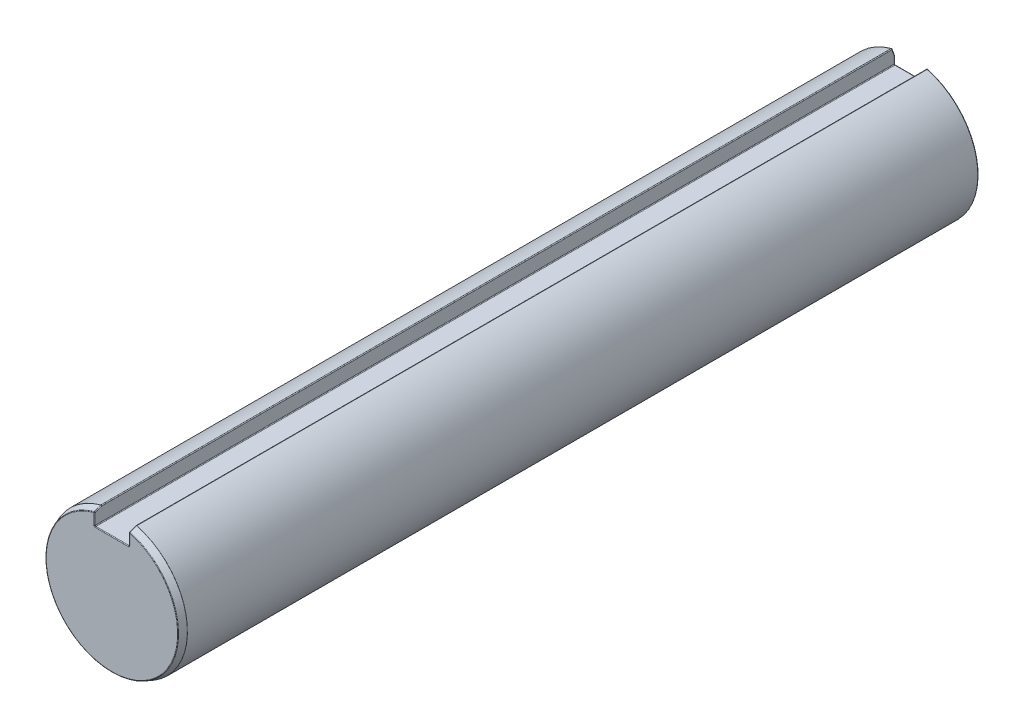
from build123d import *
from OCP.BRepFilletAPI import BRepFilletAPI_MakeChamfer

# Parameters (mm, degrees)
BOSS_EXTRUDE1_DEPTH      = 27.75
BOSS_EXTRUDE1_DEPTH_BACK = 27.75
CHAMFER1_SIZE            = 0.47625
CHAMFER1_SIZE2           = 0.173340824
FILLET1_R                = 0.047625


with BuildPart() as part:
    # Sketch3 → Boss-Extrude1 (new, two sides: drawn at the far end of the back side and taken through both)
    with BuildSketch(Plane.XY.offset(-BOSS_EXTRUDE1_DEPTH_BACK)):
        with BuildLine():
            Line((-1.1938, 3.571875), (-1.1938, 4.610449849))
            ThreePointArc((-1.1938, 4.610449849), (-2.915127249, -3.766090728), (4.7625, 0))
            ThreePointArc((4.7625, 0), (3.766090728, 2.915127249), (1.1938, 4.610449849))
            Line((1.1938, 4.610449849), (1.1938, 3.571875))
            Line((1.1938, 3.571875), (-1.1938, 3.571875))
        make_face()
    extrude(amount=BOSS_EXTRUDE1_DEPTH + BOSS_EXTRUDE1_DEPTH_BACK)

    # Chamfer1: one chamfer whose edges measure the first distance from different faces: ONE call of the kernel's chamfer builder (chamfer() names one face for all edges)
    chamfer1_edges_1 = [part.edges().sort_by_distance(p)[0] for p in [
        (-2.915127249, -3.766090728, -27.75),
    ]]
    chamfer1_side_1 = [part.faces().sort_by_distance(p)[0] for p in [
        (0, -0.164578508, -27.75),
    ]]
    chamfer1_edges_2 = [part.edges().sort_by_distance(p)[0] for p in [
        (-2.915127249, -3.766090728, 27.75),
    ]]
    chamfer1_side_2 = [part.faces().sort_by_distance(p)[0] for p in [
        (-2.915127249, -3.766090728, 13.875),
    ]]
    chamfer1 = BRepFilletAPI_MakeChamfer(part.part.solid().wrapped)
    for e in chamfer1_edges_1:
        chamfer1.Add(CHAMFER1_SIZE, CHAMFER1_SIZE2, e.wrapped, chamfer1_side_1[0].wrapped)  # the first distance lies on this face
    for e in chamfer1_edges_2:
        chamfer1.Add(CHAMFER1_SIZE, CHAMFER1_SIZE2, e.wrapped, chamfer1_side_2[0].wrapped)  # the first distance lies on this face
    add(Compound.cast(chamfer1.Shape()), mode=Mode.REPLACE)

    # Fillet1
    fillet1_edges = [part.edges().sort_by_distance(p)[0] for p in [
        (-2.791222288, -3.642727012, 27.75),
        (-1.1938, 4.36360182, -27.663482035),
        (-1.1938, 4.520858199, 27.511894109),
        (-2.574394474, -3.42701505, -27.75),
        (1.1938, 4.36360182, -27.663482035),
        (1.1938, 4.520858199, 27.511894109),
        (-2.915127249, -3.766090728, -27.576659176),
        (-2.915127249, -3.766090728, 27.27375),
        (-1.1938, 4.610449849, -13.788329588),
        (1.1938, 4.610449849, -13.788329588),
        (1.1938, 3.571875, 13.875),
        (-1.1938, 3.571875, 13.875),
        (0, 3.571875, 27.75),
        (1.1938, 4.001520014, 27.75),
        (-1.1938, 4.001520014, 27.75),
        (0, 3.571875, -27.75),
        (1.1938, 3.844260885, -27.75),
        (-1.1938, 3.844260885, -27.75),
    ]]
    fillet(fillet1_edges, radius=FILLET1_R)


solid = part.part
